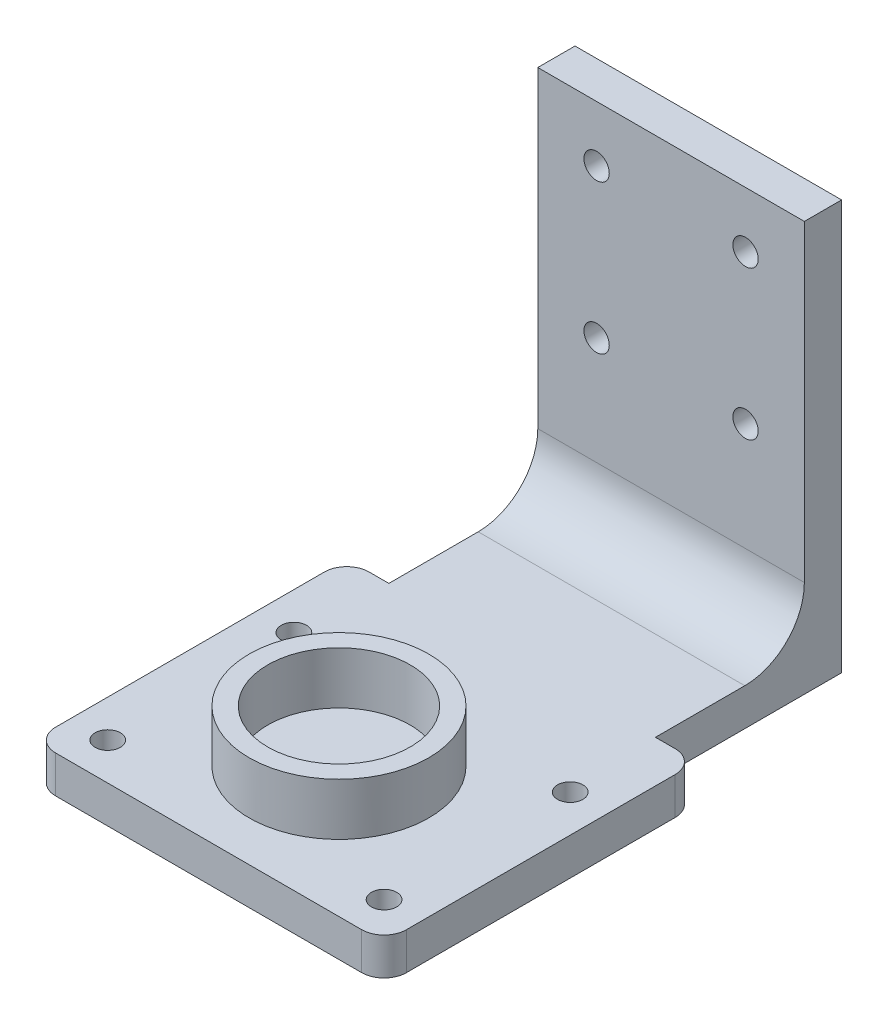
from build123d import *

# Parameters (mm, degrees)
SKETCH1_R           = 1.7
BOSS_EXTRUDE1_DEPTH = 5
SKETCH2_R           = 12.065
SKETCH2_R_2         = 9.565
BOSS_EXTRUDE2_DEPTH = 7
SKETCH3_W           = 47.11
SKETCH3_H           = 55
BOSS_EXTRUDE3_DEPTH = 5
SKETCH4_R           = 1.7
CUT_EXTRUDE1_DEPTH  = 90.901323822
SKETCH5_W           = 5.655
SKETCH5_H           = 25
CUT_EXTRUDE2_DEPTH  = 78.717424205
FILLET3_R           = 3
FILLET4_R           = 8


with BuildPart() as part:
    # Sketch1 → Boss-Extrude1 (new body)
    with BuildSketch(Plane(origin=(0, 0, 0), x_dir=(1, 0, 0), z_dir=(0, 1, 0))):
        Polygon((-23.555, 17.5), (-23.555, -17.5), (23.555, -17.5), (23.555, 17.5), (23.555, 44.6), (-23.555, 44.6), align=None)
        with Locations(Location((-18.555, -12.5, 0), (0, 0, 270))):
            Circle(SKETCH1_R, mode=Mode.SUBTRACT)
        with Locations(Location((-18.555, 12.5, 0), (0, 0, 90))):
            Circle(SKETCH1_R, mode=Mode.SUBTRACT)
        with Locations(Location((18.555, -12.5, 0), (0, 0, 90))):
            Circle(SKETCH1_R, mode=Mode.SUBTRACT)
        with Locations(Location((18.555, 12.5, 0), (0, 0, 270))):
            Circle(SKETCH1_R, mode=Mode.SUBTRACT)
    extrude(amount=BOSS_EXTRUDE1_DEPTH)

    # Sketch2 → Boss-Extrude2 (add)
    with BuildSketch(Plane(origin=(0, 5, 0), x_dir=(1, 0, 0), z_dir=(0, 1, 0))):
        with Locations(Location((0, 0, 0), (0, 0, 90))):
            Circle(SKETCH2_R)
        with Locations(Location((0, 0, 0), (0, 0, 270))):
            Circle(SKETCH2_R_2, mode=Mode.SUBTRACT)
    extrude(amount=BOSS_EXTRUDE2_DEPTH)

    # Sketch3 → Boss-Extrude3 (add)
    with BuildSketch(Plane(origin=(0, 0, -44.6), x_dir=(-1, 0, 0), z_dir=(0, 0, -1))):
        with Locations((0, 27.5)):
            Rectangle(SKETCH3_W, SKETCH3_H)
    extrude(amount=BOSS_EXTRUDE3_DEPTH)

    # Sketch4 → Cut-Extrude1 (cut, through all)
    with BuildSketch(Plane(origin=(0, 0, -49.6), x_dir=(-1, 0, 0), z_dir=(0, 0, -1))):
        with Locations((-10, 47.5)):
            Circle(SKETCH4_R)
        with Locations((-10, 27.5)):
            Circle(SKETCH4_R)
        with Locations((10, 27.5)):
            Circle(SKETCH4_R)
        with Locations((10, 47.5)):
            Circle(SKETCH4_R)
    extrude(amount=-CUT_EXTRUDE1_DEPTH, mode=Mode.SUBTRACT)

    # Sketch5 → Cut-Extrude2 (cut, through all)
    with BuildSketch(Plane(origin=(0, 55, 0), x_dir=(1, 0, 0), z_dir=(0, 1, 0))):
        with Locations((-20.7275, 37.1)):
            Rectangle(SKETCH5_W, SKETCH5_H)
        with Locations((20.7275, 37.1)):
            Rectangle(SKETCH5_W, SKETCH5_H)
    extrude(amount=-CUT_EXTRUDE2_DEPTH, mode=Mode.SUBTRACT)

    # Fillet3
    fillet3_edges = [part.edges().sort_by_distance(p)[0] for p in [
        (23.555, 2.5, -24.6),
        (23.555, 2.5, 17.5),
        (-23.555, 2.5, 17.5),
        (-23.555, 2.5, -24.6),
    ]]
    fillet(fillet3_edges, radius=FILLET3_R)

    # Fillet4
    fillet4_edges = [part.edges().sort_by_distance(p)[0] for p in [
        (0, 5, -44.6),
    ]]
    fillet(fillet4_edges, radius=FILLET4_R)


solid = part.part
